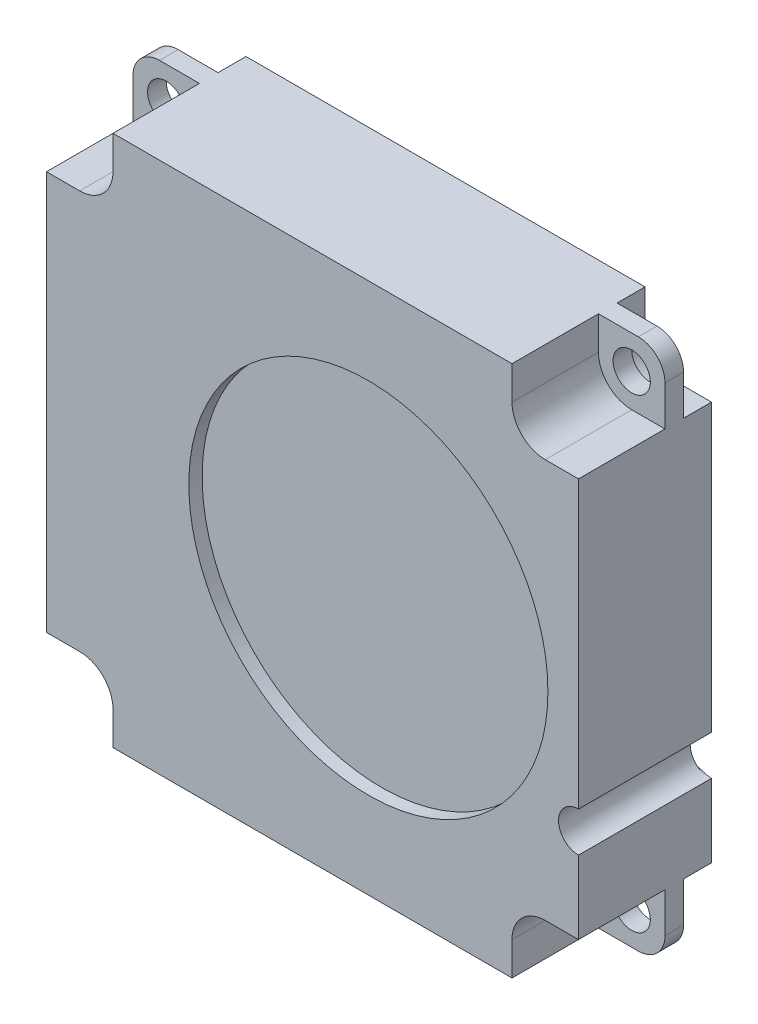
from build123d import *

# Parameters (mm, degrees)
SKETCH_1_W          = 40
SKETCH_1_H          = 40
EXTRUDE_1_DEPTH     = 10
SKETCH_2_R          = 1.4
CUT_EXTRUDE_1_DEPTH = 58.445626465
SKETCH_3_R          = 13.5
CUT_EXTRUDE_2_DEPTH = 1
SKETCH_4_W          = 28
SKETCH_4_H          = 8.6
CUT_EXTRUDE_3_DEPTH = 5
CUT_EXTRUDE_4_DEPTH = 6.5
CUT_EXTRUDE_START   = -2.1
CUT_EXTRUDE_5_DEPTH = 2.1
FILLET_2_R          = 2
SKETCH_8_R          = 1.5
CUT_EXTRUDE_6_DEPTH = 58.445626465
CUT_EXTRUDE_START_2 = -0.1
CUT_EXTRUDE_7_DEPTH = 0.1


with BuildPart() as part:
    # Эскиз1 → Бобышка-Вытянуть1 (new body)
    with BuildSketch(Plane.XY):
        with Locations((20, 20)):
            Rectangle(SKETCH_1_W, SKETCH_1_H)
    extrude(amount=EXTRUDE_1_DEPTH)

    # Эскиз2 → Вырез-Вытянуть1 (cut, through all)
    with BuildSketch(Plane.XY.offset(10)):
        with Locations((2.5, 37.5)):
            Circle(SKETCH_2_R)
        with Locations((37.5, 37.5)):
            Circle(SKETCH_2_R)
        with Locations((37.5, 2.5)):
            Circle(SKETCH_2_R)
        with Locations((2.5, 2.5)):
            Circle(SKETCH_2_R)
    extrude(amount=-CUT_EXTRUDE_1_DEPTH, mode=Mode.SUBTRACT)

    # Эскиз3 → Вырез-Вытянуть2 (cut)
    with BuildSketch(Plane.XY.offset(10)):
        with Locations((24.2, 20)):
            Circle(SKETCH_3_R)
    extrude(amount=-CUT_EXTRUDE_2_DEPTH, mode=Mode.SUBTRACT)

    # Эскиз4 → Вырез-Вытянуть3 (cut)
    with BuildSketch(Plane.XZ):
        with Locations((20, 5)):
            Rectangle(SKETCH_4_W, SKETCH_4_H)
    extrude(amount=-CUT_EXTRUDE_3_DEPTH, mode=Mode.SUBTRACT)

    # Эскиз5 → Вырез-Вытянуть4 (cut)
    with BuildSketch(Plane.XY.offset(10)):
        with BuildLine():
            Line((2.5, 35), (0, 35))
            Line((0, 35), (0, 40))
            Line((0, 40), (5, 40))
            Line((5, 40), (5, 37.5))
            ThreePointArc((5, 37.5), (4.267766953, 35.732233047), (2.5, 35))
        make_face()
        with BuildLine():
            Line((35, 40), (35, 37.5))
            ThreePointArc((35, 37.5), (35.732233047, 35.732233047), (37.5, 35))
            Line((37.5, 35), (40, 35))
            Line((40, 35), (40, 40))
            Line((40, 40), (35, 40))
        make_face()
        with BuildLine():
            Line((37.5, 5), (40, 5))
            Line((40, 5), (40, 0))
            Line((40, 0), (35, 0))
            Line((35, 0), (35, 2.5))
            ThreePointArc((35, 2.5), (35.732233047, 4.267766953), (37.5, 5))
        make_face()
        with BuildLine():
            Line((5, 0), (5, 2.5))
            ThreePointArc((5, 2.5), (4.267766953, 4.267766953), (2.5, 5))
            Line((2.5, 5), (0, 5))
            Line((0, 5), (0, 0))
            Line((0, 0), (5, 0))
        make_face()
    extrude(amount=-CUT_EXTRUDE_4_DEPTH, mode=Mode.SUBTRACT)

    # Эскиз6 → Вырез-Вытянуть5 (cut)
    with BuildSketch(Plane(origin=(0, 0, 0), x_dir=(-1, 0, 0), z_dir=(0, 0, -1)).offset(CUT_EXTRUDE_START)):
        with BuildLine():
            Line((-2.5, 35), (0, 35))
            Line((0, 35), (0, 40))
            Line((0, 40), (-5, 40))
            Line((-5, 40), (-5, 37.5))
            ThreePointArc((-5, 37.5), (-4.267766953, 35.732233047), (-2.5, 35))
        make_face()
        with BuildLine():
            Line((-35, 37.5), (-35, 40))
            Line((-35, 40), (-40, 40))
            Line((-40, 40), (-40, 35))
            Line((-40, 35), (-37.5, 35))
            ThreePointArc((-37.5, 35), (-35.732233047, 35.732233047), (-35, 37.5))
        make_face()
        with BuildLine():
            Line((-5, 0), (0, 0))
            Line((0, 0), (0, 5))
            Line((0, 5), (-2.5, 5))
            ThreePointArc((-2.5, 5), (-4.267766953, 4.267766953), (-5, 2.5))
            Line((-5, 2.5), (-5, 0))
        make_face()
        with BuildLine():
            Line((-40, 5), (-40, 0))
            Line((-40, 0), (-35, 0))
            Line((-35, 0), (-35, 2.5))
            ThreePointArc((-35, 2.5), (-35.732233047, 4.267766953), (-37.5, 5))
            Line((-37.5, 5), (-40, 5))
        make_face()
    extrude(amount=CUT_EXTRUDE_5_DEPTH, mode=Mode.SUBTRACT)

    # Скругление2
    fillet_2_edges = [part.edges().sort_by_distance(p)[0] for p in [
        (0, 40, 2.8),
        (40, 40, 2.8),
        (40, 0, 2.8),
        (0, 0, 2.8),
    ]]
    fillet(fillet_2_edges, radius=FILLET_2_R)

    # Эскиз8 → Вырез-Вытянуть6 (cut, through all)
    with BuildSketch(Plane.XY.offset(10)):
        with Locations((40, 12)):
            Circle(SKETCH_8_R)
    extrude(amount=-CUT_EXTRUDE_6_DEPTH, mode=Mode.SUBTRACT)

    # Эскиз9 → Вырез-Вытянуть7 (cut)
    with BuildSketch(Plane(origin=(0, 0, 0), x_dir=(-1, 0, 0), z_dir=(0, 0, -1)).offset(CUT_EXTRUDE_START_2)):
        with BuildLine():
            Line((-40, 13.5), (-33.314476962, 15.672794987))
            ThreePointArc((-33.314476962, 15.672794987), (-7.214062681, 25.702614039), (-32.115767056, 12.985145144))
            Line((-32.115767056, 12.985145144), (-39.536370891, 10.573448897))
            ThreePointArc((-39.536370891, 10.573448897), (-38.518476012, 12.234705502), (-40, 13.5))
        make_face()
    extrude(amount=CUT_EXTRUDE_7_DEPTH, mode=Mode.SUBTRACT)


solid = part.part
